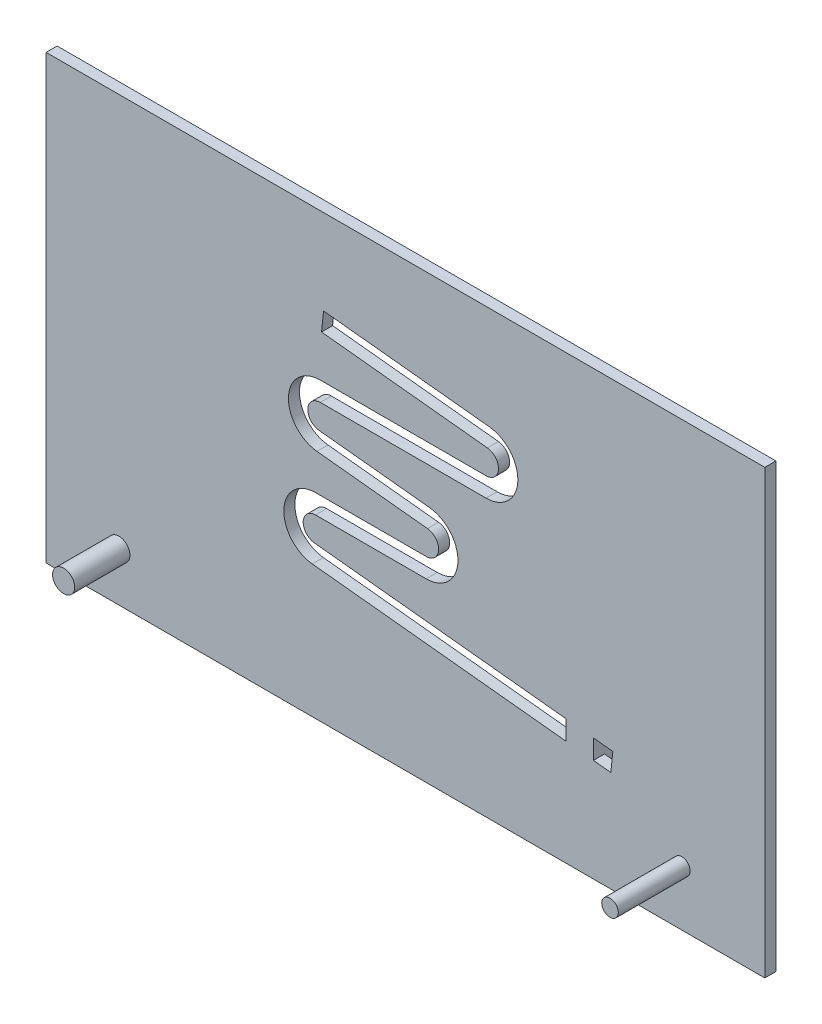
from build123d import *

# Parameters (mm, degrees)
SKETCH1_W                = 130
SKETCH1_H                = 80
BOSS_EXTRUDE1_DEPTH      = 2
CUT_EXTRUDE_THIN1_DEPTH  = 3.2
BOSS_EXTRUDE2_DEPTH      = 10
BOSS_EXTRUDE2_DEPTH_BACK = 15
SKETCH5_R                = 1.5
BOSS_EXTRUDE3_DEPTH      = 10
BOSS_EXTRUDE3_DEPTH_BACK = 12
SKETCH6_R                = 2
SKETCH9_W                = 5
SKETCH9_H                = 50
BOSS_EXTRUDE5_DEPTH      = 10.5
SKETCH11_R               = 1.5
CUT_EXTRUDE1_DEPTH       = 7.5


with BuildPart() as part:
    # Sketch1 → Boss-Extrude1 (new body)
    with BuildSketch(Plane.XY):
        with Locations((65, 40)):
            Rectangle(SKETCH1_W, SKETCH1_H)
    extrude(amount=BOSS_EXTRUDE1_DEPTH)

    # Sketch2 → Cut-Extrude-Thin1 (cut)
    with BuildSketch(Plane.XY.offset(2)):
        with BuildLine():
            Line((49.817075189, 61.102777477), (79.817075189, 57.949650419))
            ThreePointArc((79.817075189, 57.949650419), (81.8288026, 55.594220253), (79.581886147, 53.461976154))
            Line((79.581886147, 53.461976154), (49.581886147, 53.461976154))
            ThreePointArc((49.581886147, 53.461976154), (43.839766322, 48.012907902), (48.980847483, 41.993475256))
            Line((48.980847483, 41.993475256), (68.980847483, 39.89139055))
            ThreePointArc((68.980847483, 39.89139055), (70.992574894, 37.535960384), (68.745658441, 35.403716286))
            Line((68.745658441, 35.403716286), (48.745658441, 35.403716286))
            ThreePointArc((48.745658441, 35.403716286), (43.003538616, 29.954648034), (48.144619777, 23.935215387))
            Line((48.144619777, 23.935215387), (102.144619777, 18.259586683))
            Line((102.144619777, 18.259586683), (102.510469398, 21.740413317))
            Line((102.510469398, 21.740413317), (48.510469398, 27.416042021))
            ThreePointArc((48.510469398, 27.416042021), (46.498741988, 29.771472187), (48.745658441, 31.903716286))
            Line((48.745658441, 31.903716286), (68.745658441, 31.903716286))
            ThreePointArc((68.745658441, 31.903716286), (74.487778266, 37.352784537), (69.346697105, 43.372217184))
            Line((69.346697105, 43.372217184), (49.346697105, 45.47430189))
            ThreePointArc((49.346697105, 45.47430189), (47.334969694, 47.829732056), (49.581886147, 49.961976154))
            Line((49.581886147, 49.961976154), (79.581886147, 49.961976154))
            ThreePointArc((79.581886147, 49.961976154), (85.324005972, 55.411044406), (80.182924811, 61.430477052))
            Line((80.182924811, 61.430477052), (50.182924811, 64.58360411))
            Line((50.182924811, 64.58360411), (49.817075189, 61.102777477))
        make_face()
    extrude(amount=-CUT_EXTRUDE_THIN1_DEPTH, mode=Mode.SUBTRACT)

    # Sketch5 → Boss-Extrude2 (add, two sides: drawn at the far end of the back side and taken through both)
    with BuildSketch(Plane(origin=(0, 0, 0), x_dir=(-1, 0, 0), z_dir=(0, 0, -1)).offset(-BOSS_EXTRUDE2_DEPTH_BACK)):
        with Locations((-115, 10)):
            Circle(SKETCH5_R)
    extrude(amount=BOSS_EXTRUDE2_DEPTH + BOSS_EXTRUDE2_DEPTH_BACK)

    # Sketch6 → Boss-Extrude3 (add, two sides: drawn at the far end of the back side and taken through both)
    with BuildSketch(Plane(origin=(0, 0, 0), x_dir=(-1, 0, 0), z_dir=(0, 0, -1)).offset(-BOSS_EXTRUDE3_DEPTH_BACK)):
        with Locations((-13.162577251, 8.793885197)):
            Circle(SKETCH6_R)
    extrude(amount=BOSS_EXTRUDE3_DEPTH + BOSS_EXTRUDE3_DEPTH_BACK)

    # Sketch9 → Boss-Extrude5 (add)
    with BuildSketch(Plane.XY.offset(2)):
        with Locations((96.5, 40)):
            Rectangle(SKETCH9_W, SKETCH9_H)
    extrude(amount=-BOSS_EXTRUDE5_DEPTH)

    # Sketch11 → Cut-Extrude1 (cut)
    with BuildSketch(Plane.ZY.offset(-94)):
        with Locations((-4.25, 55.711976154)):
            Circle(SKETCH11_R)
        with Locations((-4.25, 37.653716286)):
            Circle(SKETCH11_R)
        with Locations((-4.25, 22.837814352)):
            Circle(SKETCH11_R)
    extrude(amount=-CUT_EXTRUDE1_DEPTH, mode=Mode.SUBTRACT)


solid = part.part
